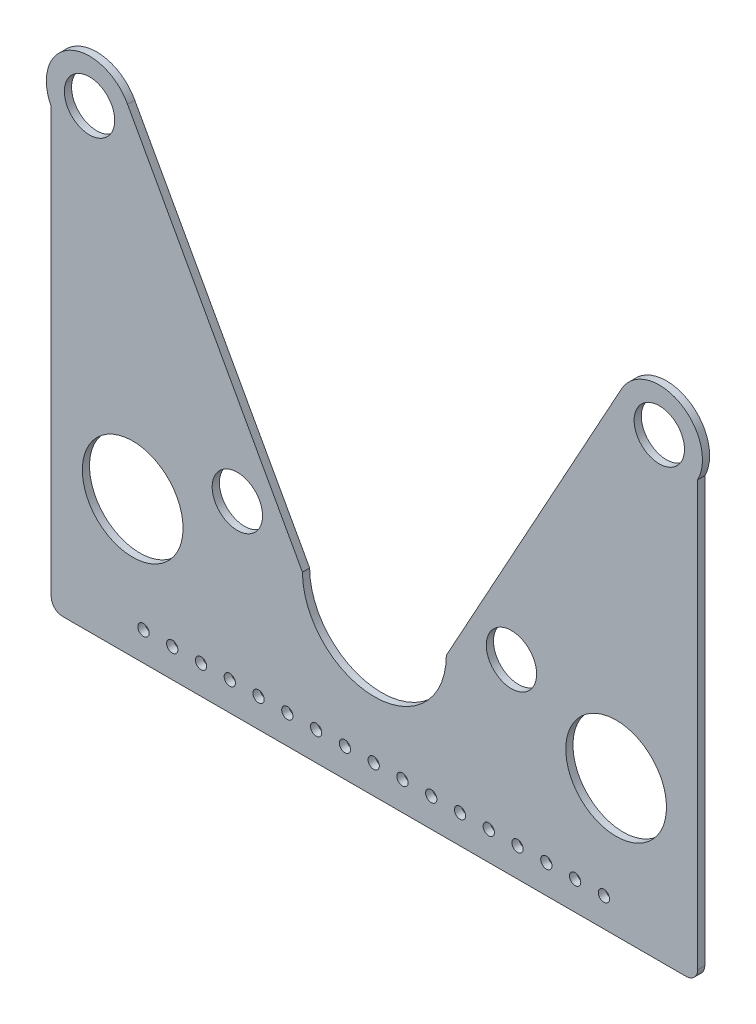
from build123d import *

# Parameters (mm, degrees)
SKETCH2_R           = 11.1125
SKETCH2_R_2         = 2.4892
SKETCH2_R_3         = 22.225
BOSS_EXTRUDE1_DEPTH = 3.175


with BuildPart() as part:
    # Sketch2 → Boss-Extrude1 (new body)
    with BuildSketch(Plane.XY):
        with BuildLine():
            Line((-142.632381685, -29.937060043), (-142.632381685, -64.77))
            ThreePointArc((-142.632381685, -64.77), (-141.144484133, -68.362102448), (-137.552381685, -69.85))
            Line((-137.552381685, -69.85), (137.552381685, -69.85))
            ThreePointArc((137.552381685, -69.85), (141.144484133, -68.362102448), (142.632381685, -64.77))
            Line((142.632381685, -64.77), (142.632381685, -29.937060043))
            Line((142.632381685, -29.937060043), (142.632381685, 122.462939957))
            ThreePointArc((142.632381685, 122.462939957), (134.600001748, 148.101160684), (108.918256203, 140.209048469))
            Line((108.918256203, 140.209048469), (31.75, 0))
            ThreePointArc((31.75, 0), (0, -31.75), (-31.75, 0))
            Line((-31.75, 0), (-108.918256203, 140.209048469))
            ThreePointArc((-108.918256203, 140.209048469), (-134.600001748, 148.101160684), (-142.632381685, 122.462939957))
            Line((-142.632381685, 122.462939957), (-142.632381685, -29.937060043))
        make_face()
        with Locations((-60.484532313, 12.7)):
            Circle(SKETCH2_R, mode=Mode.SUBTRACT)
        with Locations((-125.726814921, 131.243846084)):
            Circle(SKETCH2_R, mode=Mode.SUBTRACT)
        with Locations((125.726814921, 131.243846084)):
            Circle(SKETCH2_R, mode=Mode.SUBTRACT)
        with Locations((-101.9175, -57.15)):
            Circle(SKETCH2_R_2, mode=Mode.SUBTRACT)
        with Locations((60.484532313, 12.7)):
            Circle(SKETCH2_R, mode=Mode.SUBTRACT)
        with Locations((-89.2175, -57.15)):
            Circle(SKETCH2_R_2, mode=Mode.SUBTRACT)
        with Locations((-76.5175, -57.15)):
            Circle(SKETCH2_R_2, mode=Mode.SUBTRACT)
        with Locations((-63.8175, -57.15)):
            Circle(SKETCH2_R_2, mode=Mode.SUBTRACT)
        with Locations((-51.1175, -57.15)):
            Circle(SKETCH2_R_2, mode=Mode.SUBTRACT)
        with Locations((-38.4175, -57.15)):
            Circle(SKETCH2_R_2, mode=Mode.SUBTRACT)
        with Locations((-25.7175, -57.15)):
            Circle(SKETCH2_R_2, mode=Mode.SUBTRACT)
        with Locations((-13.0175, -57.15)):
            Circle(SKETCH2_R_2, mode=Mode.SUBTRACT)
        with Locations((-0.3175, -57.15)):
            Circle(SKETCH2_R_2, mode=Mode.SUBTRACT)
        with Locations((12.3825, -57.15)):
            Circle(SKETCH2_R_2, mode=Mode.SUBTRACT)
        with Locations((25.0825, -57.15)):
            Circle(SKETCH2_R_2, mode=Mode.SUBTRACT)
        with Locations((37.7825, -57.15)):
            Circle(SKETCH2_R_2, mode=Mode.SUBTRACT)
        with Locations((50.4825, -57.15)):
            Circle(SKETCH2_R_2, mode=Mode.SUBTRACT)
        with Locations((63.1825, -57.15)):
            Circle(SKETCH2_R_2, mode=Mode.SUBTRACT)
        with Locations((75.8825, -57.15)):
            Circle(SKETCH2_R_2, mode=Mode.SUBTRACT)
        with Locations((88.5825, -57.15)):
            Circle(SKETCH2_R_2, mode=Mode.SUBTRACT)
        with Locations((101.2825, -57.15)):
            Circle(SKETCH2_R_2, mode=Mode.SUBTRACT)
        with Locations((-106.68, -9.525)):
            Circle(SKETCH2_R_3, mode=Mode.SUBTRACT)
        with Locations((106.68, -9.525)):
            Circle(SKETCH2_R_3, mode=Mode.SUBTRACT)
    extrude(amount=BOSS_EXTRUDE1_DEPTH)


solid = part.part
